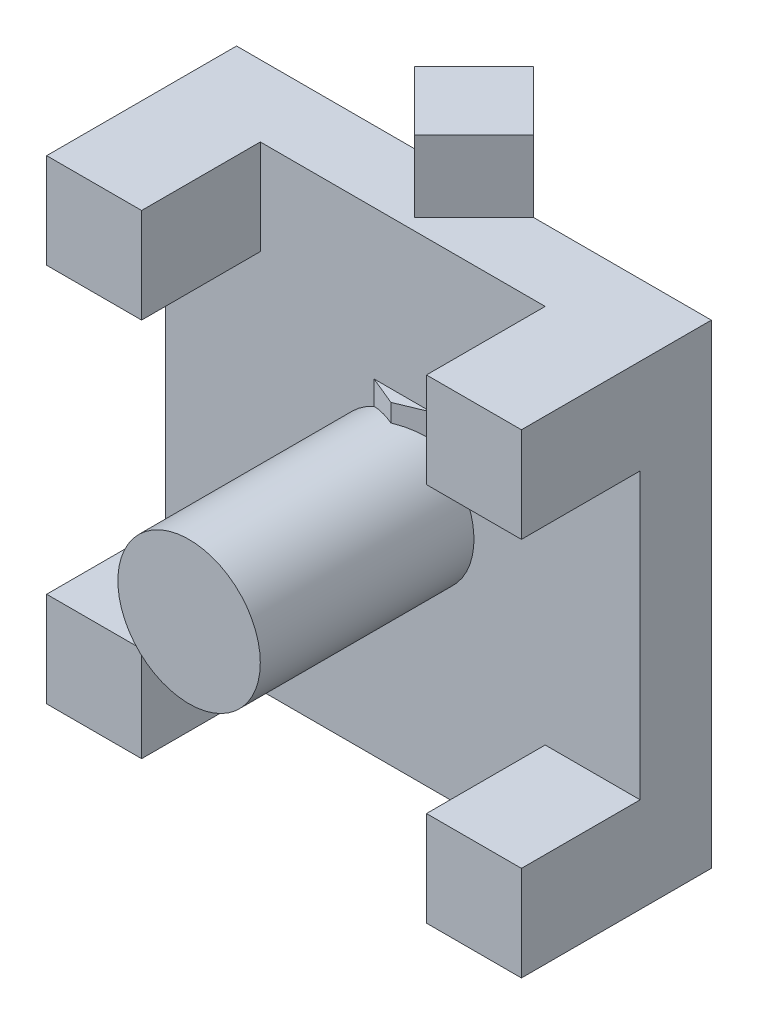
from build123d import *

# Parameters (mm, degrees)
SKETCH_1_W          = 2000
SKETCH_1_H          = 2000
EXTRUDE_1_DEPTH     = 300
SKETCH_2_W          = 400
SKETCH_2_H          = 400
EXTRUDE_2_DEPTH     = 800
SKETCH_3_W          = 400
SKETCH_3_H          = 400
EXTRUDE_3_DEPTH     = 800
SKETCH_4_W          = 400
SKETCH_4_H          = 400
EXTRUDE_4_DEPTH     = 800
SKETCH_5_W          = 400
SKETCH_5_H          = 400
EXTRUDE_5_DEPTH     = 800
SKETCH_6_R          = 300
EXTRUDE_6_DEPTH     = 1200
SKETCH_7_W          = 400
SKETCH_7_H          = 50
CUT_EXTRUDE_1_DEPTH = 1677.305461424
EXTRUDE_7_DEPTH     = 300
EXTRUDE_8_DEPTH     = 300
EXTRUDE_9_DEPTH     = 300
EXTRUDE_10_DEPTH    = 300
EXTRUDE_11_DEPTH    = 400


with BuildPart() as part:
    # 草图1 → 凸台-拉伸1 (new body)
    with BuildSketch(Plane.XY):
        Rectangle(SKETCH_1_W, SKETCH_1_H)
    extrude(amount=EXTRUDE_1_DEPTH)

    # 草图2 → 凸台-拉伸2 (add)
    with BuildSketch(Plane.XY):
        with Locations((-800, -800)):
            Rectangle(SKETCH_2_W, SKETCH_2_H)
    extrude(amount=EXTRUDE_2_DEPTH)

    # 草图3 → 凸台-拉伸3 (add)
    with BuildSketch(Plane.XY):
        with Locations((800, -800)):
            Rectangle(SKETCH_3_W, SKETCH_3_H)
    extrude(amount=EXTRUDE_3_DEPTH)

    # 草图4 → 凸台-拉伸4 (add)
    with BuildSketch(Plane.XY):
        with Locations((-800, 800)):
            Rectangle(SKETCH_4_W, SKETCH_4_H)
    extrude(amount=EXTRUDE_4_DEPTH)

    # 草图5 → 凸台-拉伸5 (add)
    with BuildSketch(Plane.XY):
        with Locations((800, 800)):
            Rectangle(SKETCH_5_W, SKETCH_5_H)
    extrude(amount=EXTRUDE_5_DEPTH)

    # 草图6 → 凸台-拉伸6 (add)
    with BuildSketch(Plane.XY):
        with Locations(Location((0, 0, 0), (0, 0, 180))):
            Circle(SKETCH_6_R)
    extrude(amount=EXTRUDE_6_DEPTH)

    # 草图7 → 切除-拉伸1 (cut, through all)
    with BuildSketch(Plane.XY.offset(300)):
        Rectangle(SKETCH_7_W, SKETCH_7_H)
    extrude(amount=-CUT_EXTRUDE_1_DEPTH, mode=Mode.SUBTRACT)

    # 草图8 → 凸台-拉伸7 (add)
    with BuildSketch(Plane(origin=(0, -600, 0), x_dir=(1, 0, 0), z_dir=(0, 1, 0))):
        Polygon((250, 0), (0, 250), (-250, 0), (0, -250), align=None)
    extrude(amount=EXTRUDE_7_DEPTH)

    # 草图9 → 凸台-拉伸8 (add)
    with BuildSketch(Plane(origin=(0, -600, 0), x_dir=(1, 0, 0), z_dir=(0, 1, 0))):
        Polygon((250, 0), (0, 250), (-250, 0), (0, -250), align=None)
    extrude(amount=EXTRUDE_8_DEPTH)

    # 草图10 → 凸台-拉伸9 (add)
    with BuildSketch(Plane(origin=(0, 1000, 0), x_dir=(1, 0, 0), z_dir=(0, 1, 0))):
        Polygon((250, 0), (0, 250), (-250, 0), (0, -250), align=None)
    extrude(amount=EXTRUDE_9_DEPTH)

    # 草图11 → 凸台-拉伸10 (add)
    with BuildSketch(Plane(origin=(0, 1000, 0), x_dir=(1, 0, 0), z_dir=(0, 1, 0))):
        Polygon((250, 0), (0, 250), (-250, 0), (0, -250), align=None)
    extrude(amount=EXTRUDE_10_DEPTH)

    # 草图12 → 凸台-拉伸11 (add)
    with BuildSketch(Plane(origin=(0, -25, 0), x_dir=(1, 0, 0), z_dir=(0, 1, 0))):
        Polygon((350, 0), (247.487373415, 247.487373415), (0, 350), (-247.487373415, 247.487373415), (-350, 0), (-247.487373415, -247.487373415), (0, -350), (247.487373415, -247.487373415), align=None)
    extrude(amount=EXTRUDE_11_DEPTH)


solid = part.part
